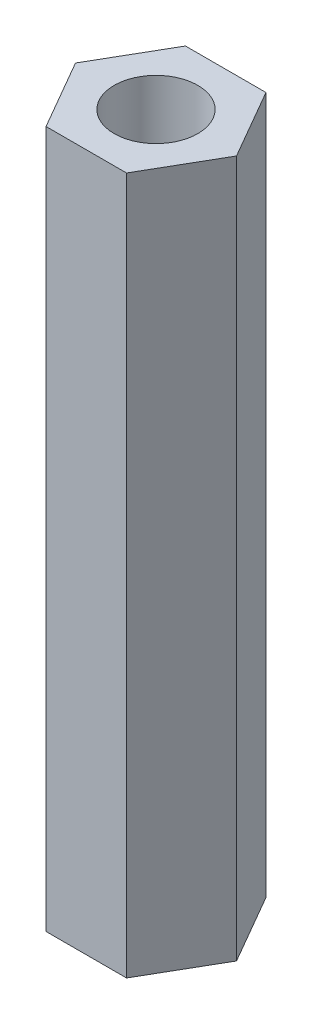
from build123d import *

# Parameters (mm, degrees)
BOSS_EXTRUDE1_DEPTH = 25
SKETCH2_R           = 1.5
CUT_EXTRUDE1_DEPTH  = 25


with BuildPart() as part:
    # Sketch1 → Boss-Extrude1 (new body)
    with BuildSketch(Plane(origin=(0, 0, 0), x_dir=(1, 0, 0), z_dir=(0, 1, 0))):
        Polygon((2.886751346, 0), (1.443375673, 2.5), (-1.443375673, 2.5), (-2.886751346, 0), (-1.443375673, -2.5), (1.443375673, -2.5), align=None)
    extrude(amount=BOSS_EXTRUDE1_DEPTH)

    # Sketch2 → Cut-Extrude1 (cut)
    with BuildSketch(Plane(origin=(0, 25, 0), x_dir=(1, 0, 0), z_dir=(0, 1, 0))):
        with Locations(Location((0, 0, 0), (0, 0, 270))):
            Circle(SKETCH2_R)
    extrude(amount=-CUT_EXTRUDE1_DEPTH, mode=Mode.SUBTRACT)


solid = part.part
